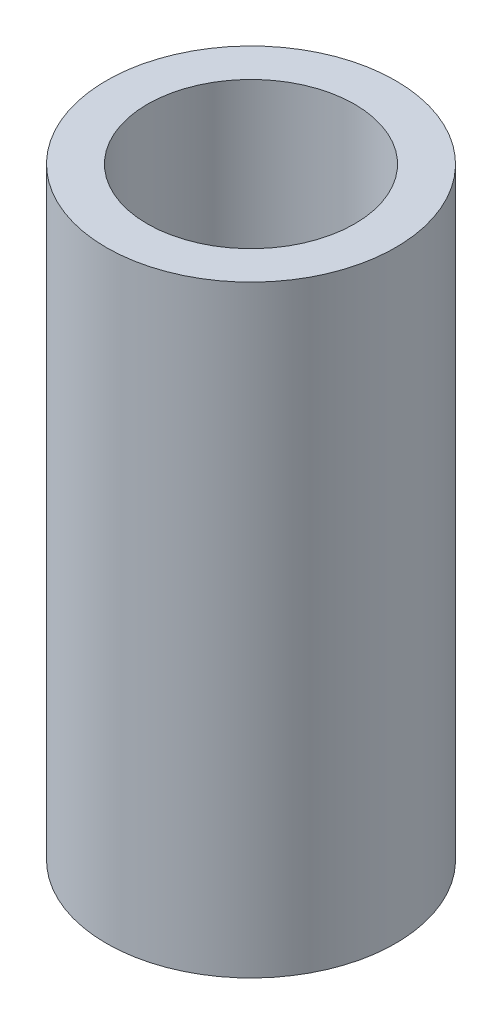
from build123d import *

# Parameters (mm, degrees)
CROQUIS1_R              = 6
CROQUIS1_R_2            = 4.3
SALIENTE_EXTRUIR1_DEPTH = 25


with BuildPart() as part:
    # Croquis1 → Saliente-Extruir1 (new body)
    with BuildSketch(Plane(origin=(0, 0, 0), x_dir=(1, 0, 0), z_dir=(0, 1, 0))):
        with Locations(Location((0, 0, 0), (0, 0, 270))):
            Circle(CROQUIS1_R)
        with Locations(Location((0, 0, 0), (0, 0, 270))):
            Circle(CROQUIS1_R_2, mode=Mode.SUBTRACT)
    extrude(amount=SALIENTE_EXTRUIR1_DEPTH)


solid = part.part
